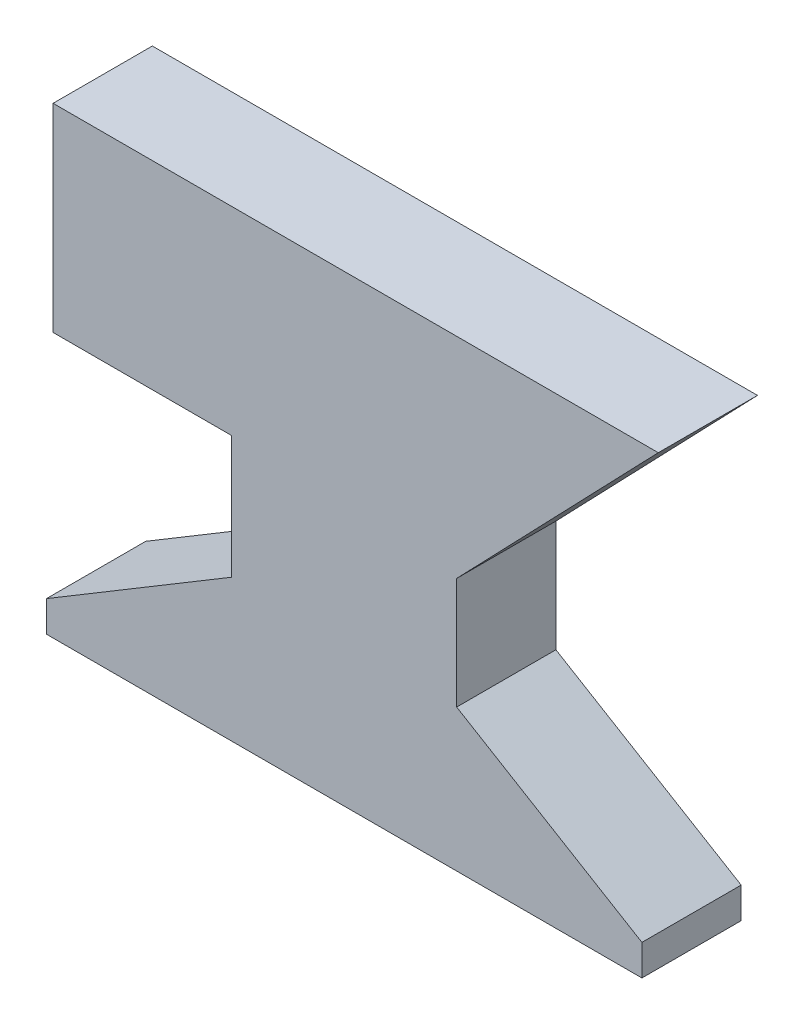
from build123d import *

# Parameters (mm, degrees)
EXTRUDE_1_DEPTH = 5
EXTRUDE_2_DEPTH = 7.5


with BuildPart() as part:
    # 草图1 → 凸台-拉伸1 (new body)
    with BuildSketch(Plane.XY):
        Polygon((-101.128293069, 0), (-86.128293069, 9), (-86.128293069, 21), (-98.628293069, 21), (-98.628293069, 34), (-58.628293069, 34), (-71.128293069, 21), (-71.128293069, 9), (-56.128293069, 0), align=None)
    extrude(amount=EXTRUDE_1_DEPTH)

    # 草图2 → 凸台-拉伸2 (add)
    with BuildSketch(Plane(origin=(0, 0, 5), x_dir=(-1, 0, 0), z_dir=(0, 0, -1))):
        Polygon((54.8921871, 35), (70.128293069, 19.154449793), (70.128293069, 10.732380758), (56.128293069, 2.332380758), (56.128293069, 0), (71.128293069, 9), (71.128293069, 21), (58.628293069, 34), (98.628293069, 34), (98.628293069, 21), (86.128293069, 21), (86.128293069, 9), (101.128293069, 0), (101.128293069, 2.332380758), (87.128293069, 10.732380758), (87.128293069, 20), (100.628293069, 20), (100.628293069, 29), (100.628293069, 35), align=None)
    extrude(amount=EXTRUDE_2_DEPTH)


solid = part.part
